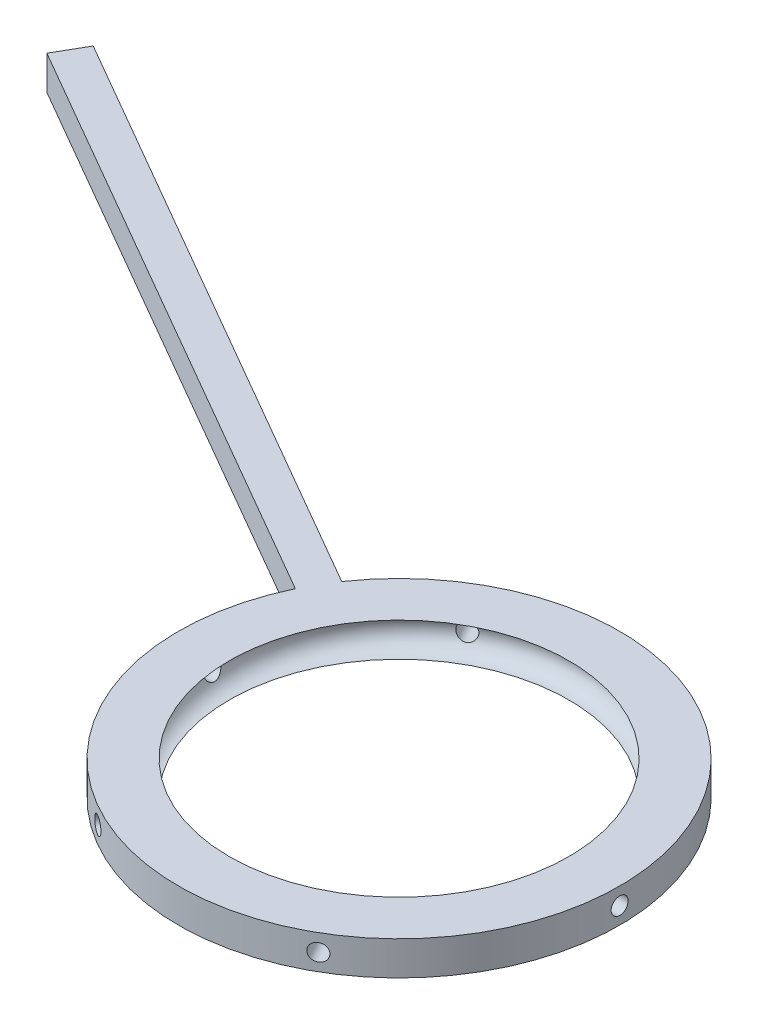
from build123d import *
from build123d.topology import SkipClean

# Parameters (mm, degrees)
SKETCH_4_R               = 25
CUT_EXTRUDE_1_DEPTH      = 1435
PATTERN_CIRCULAR_1_COUNT = 6
EXTRUDE_1_DEPTH          = 50


with BuildPart() as part:
    # 草图2 → 旋转1 (revolve)
    with BuildSketch(Plane.XY, mode=Mode.PRIVATE) as revolve_1_sk:
        with BuildLine():
            Line((-500, -50), (-650, -50))
            Line((-650, -50), (-650, 50))
            Line((-650, 50), (-500, 50))
            ThreePointArc((-500, 50), (-550, 0), (-500, -50))
        make_face()
    revolve(revolve_1_sk.sketch.rotate(Axis((0, 223.354677882, 0), (0, -1, 0)), 270), axis=Axis((0, 223.354677882, 0), (0, -1, 0)))

    # 草图4 → 切除-拉伸1 (cut)
    with BuildSketch(Plane(origin=(0, 0, 0), x_dir=(0, 0, -1), z_dir=(1, 0, 0))):
        Circle(SKETCH_4_R)
    cut_extrude_1 = extrude(amount=-CUT_EXTRUDE_1_DEPTH, mode=Mode.SUBTRACT)

    # 阵列(圆周)1: 切除-拉伸1 ×6 about axis
    with SkipClean():  # the faces are left unmerged after this step: merging them gives an invalid solid
        pattern_circular_1_axis = Axis((0, 50, 0), (0, 1, 0))
        for i in range(1, PATTERN_CIRCULAR_1_COUNT):
            add(cut_extrude_1.rotate(pattern_circular_1_axis, i * 360 / PATTERN_CIRCULAR_1_COUNT), mode=Mode.SUBTRACT)

    # 草图5 → 凸台-拉伸1 (add, symmetric)
    with SkipClean():  # the faces are left unmerged after this step: merging them gives an invalid solid
        with BuildSketch(Plane(origin=(0, 0, 0), x_dir=(1, 0, 0), z_dir=(0, 1, 0))):
            with BuildLine():
                Line((-536.248608016, 367.33830511), (-2268.299415585, 1367.33830511))
                Line((-2268.299415585, 1367.33830511), (-2318.299415585, 1280.735764731))
                Line((-2318.299415585, 1280.735764731), (-586.248608016, 280.735764731))
                ThreePointArc((-586.248608016, 280.735764731), (-562.91651246, 325), (-536.248608016, 367.33830511))
            make_face()
        extrude(amount=EXTRUDE_1_DEPTH, both=True)


solid = part.part
